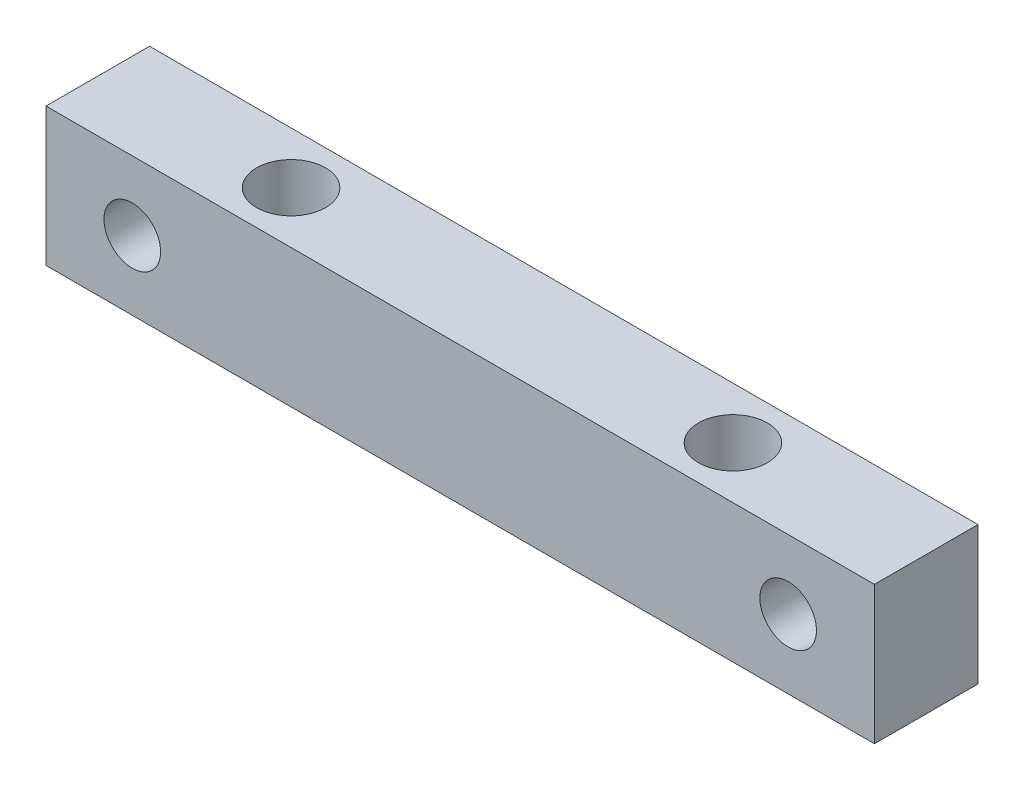
from build123d import *

# Parameters (mm, degrees)
SKETCH1_W           = 76.2
SKETCH1_H           = 9.525
SKETCH1_R           = 3.175
BOSS_EXTRUDE1_DEPTH = 12.7
CUT_EXTRUDE1_REACH  = 803.818
SKETCH2_R           = 2.6035


with BuildPart() as part:
    # Sketch1 → Boss-Extrude1 (new body)
    with BuildSketch(Plane(origin=(0, 788.156140976, 0), x_dir=(1, 0, 0), z_dir=(0, 1, 0))):
        with Locations((0, 58.7375)):
            Rectangle(SKETCH1_W, SKETCH1_H)
        with Locations(Location((-20.32, 58.7375, 0), (0, 0, 270))):
            Circle(SKETCH1_R, mode=Mode.SUBTRACT)
        with Locations(Location((20.32, 58.7375, 0), (0, 0, 90))):
            Circle(SKETCH1_R, mode=Mode.SUBTRACT)
    extrude(amount=BOSS_EXTRUDE1_DEPTH)

    # Sketch2 → Cut-Extrude1 (cut, up to next)
    with BuildSketch(Plane(origin=(0, 0, -63.5), x_dir=(-1, 0, 0), z_dir=(0, 0, -1)), mode=Mode.PRIVATE) as cut_extrude1_sk1:
        with Locations((30.1625, 794.506140976)):
            Circle(SKETCH2_R)
    cut_extrude1_tool1 = extrude(cut_extrude1_sk1.sketch, amount=-CUT_EXTRUDE1_REACH, mode=Mode.PRIVATE) & part.part
    # Sketch2 → Cut-Extrude1 (cut, up to next)
    with BuildSketch(Plane(origin=(0, 0, -63.5), x_dir=(-1, 0, 0), z_dir=(0, 0, -1)), mode=Mode.PRIVATE) as cut_extrude1_sk2:
        with Locations((-30.1625, 794.506140976)):
            Circle(SKETCH2_R)
    cut_extrude1_tool2 = extrude(cut_extrude1_sk2.sketch, amount=-CUT_EXTRUDE1_REACH, mode=Mode.PRIVATE) & part.part
    add(cut_extrude1_tool1.solids().sort_by_distance((-30.1625, 794.506141, -63.5))[0], mode=Mode.SUBTRACT)
    add(cut_extrude1_tool2.solids().sort_by_distance((30.1625, 794.506141, -63.5))[0], mode=Mode.SUBTRACT)


solid = part.part
